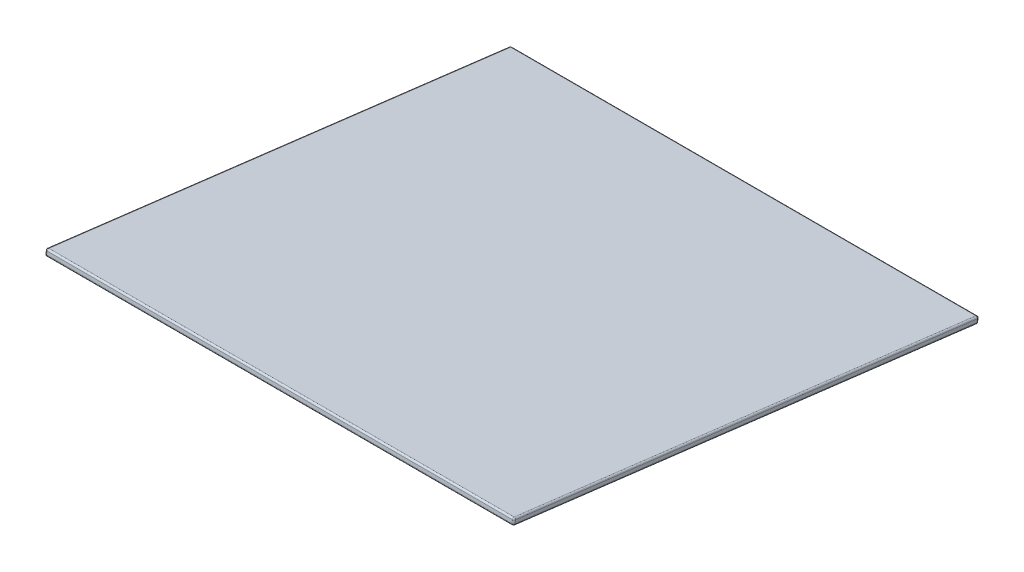
from build123d import *

# Parameters (mm, degrees)
SKETCH1_W           = 145
SKETCH1_H           = 145
BOSS_EXTRUDE1_DEPTH = 2
FILLET1_R           = 0.5


with BuildPart() as part:
    # Sketch1 → Boss-Extrude1 (new body)
    with BuildSketch(Plane(origin=(0, -4.649621963, 0.570901791), x_dir=(1, 0, 0), z_dir=(0, 0.992546151641323, -0.12186934340514075))):
        Rectangle(SKETCH1_W, SKETCH1_H)
    extrude(amount=BOSS_EXTRUDE1_DEPTH)

    # Fillet1
    fillet1_edges = [part.edges().sort_by_distance(p)[0] for p in [
        (-72.5, -2.664529659, 0.327163104),
        (0, -11.500057056, -71.63243289),
        (72.5, -2.664529659, 0.327163104),
        (0, -13.48514936, -71.388694203),
        (-72.5, -4.649621963, 0.570901791),
        (0, 4.185905434, 72.530497785),
        (72.5, -4.649621963, 0.570901791),
        (72.5, -12.492603208, -71.510563546),
        (-72.5, -12.492603208, -71.510563546),
        (-72.5, 5.178451586, 72.408628442),
        (72.5, 5.178451586, 72.408628442),
        (0, 6.170997738, 72.286759098),
    ]]
    fillet(fillet1_edges, radius=FILLET1_R)


solid = part.part
